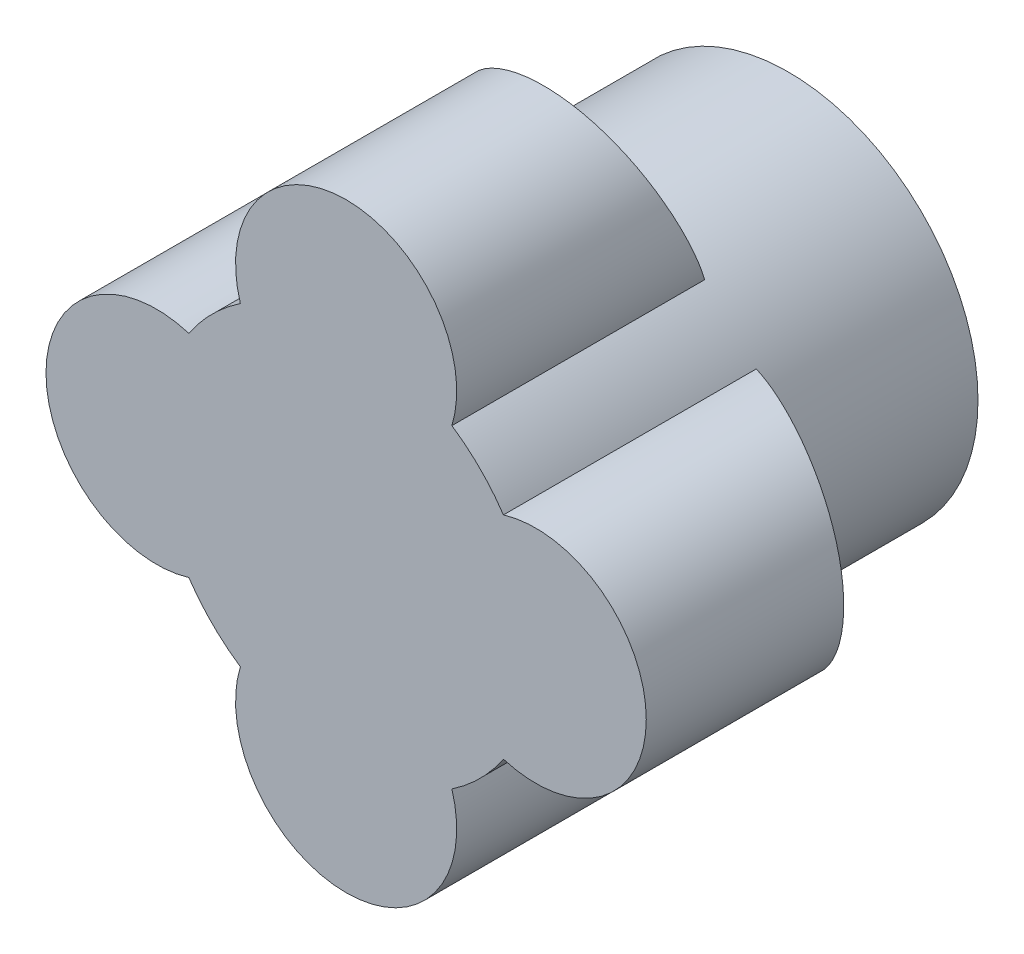
from build123d import *

# Parameters (mm, degrees)
EXTRUDE_1_DEPTH = 700


with BuildPart() as part:
    # 草图1 → 凸台-拉伸1 (new body)
    with BuildSketch(Plane.XY):
        with BuildLine():
            ThreePointArc((167.391004131, -248.958333333), (212.132034356, -212.132034356), (248.958333333, -167.391004131))
            ThreePointArc((248.958333333, -167.391004131), (475, 0), (248.958333333, 167.391004131))
            ThreePointArc((248.958333333, 167.391004131), (212.132034356, 212.132034356), (167.391004131, 248.958333333))
            ThreePointArc((167.391004131, 248.958333333), (0, 475), (-167.391004131, 248.958333333))
            ThreePointArc((-167.391004131, 248.958333333), (-212.132034356, 212.132034356), (-248.958333333, 167.391004131))
            ThreePointArc((-248.958333333, 167.391004131), (-475, 0), (-248.958333333, -167.391004131))
            ThreePointArc((-248.958333333, -167.391004131), (-212.132034356, -212.132034356), (-167.391004131, -248.958333333))
            ThreePointArc((-167.391004131, -248.958333333), (0, -475), (167.391004131, -248.958333333))
        make_face()
    extrude(amount=EXTRUDE_1_DEPTH)

    # 草图2 → 切除-旋转1 (revolve, cut)
    with BuildSketch(Plane(origin=(0, 0, 0), x_dir=(1, 0, 0), z_dir=(0, 1, 0)), mode=Mode.PRIVATE) as cut_revolve_1_sk:
        Polygon((500, -400), (500, 0), (300, 0), (300, -300), align=None)
    revolve(cut_revolve_1_sk.sketch.rotate(Axis((0, 0, 700), (0, 0, -1)), 146.0844734), axis=Axis((0, 0, 700), (0, 0, -1)), mode=Mode.SUBTRACT)


solid = part.part
